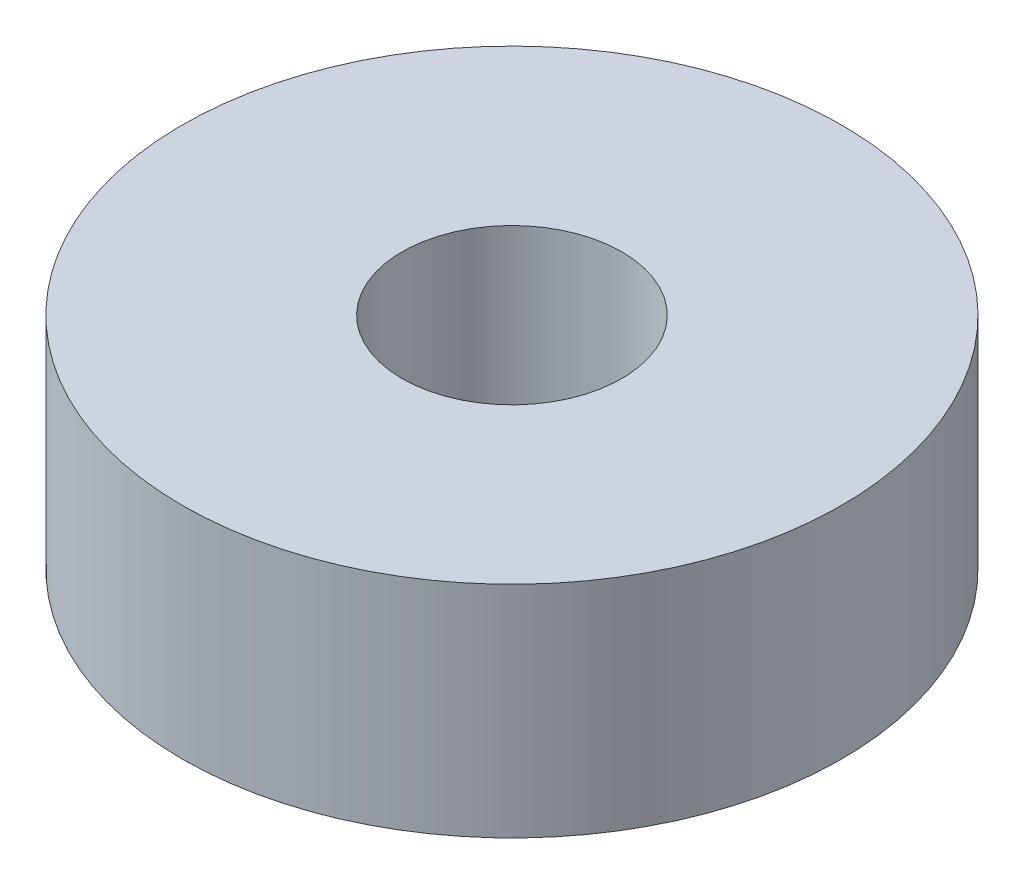
from build123d import *

# Parameters (mm, degrees)
SKETCH1_R           = 6
SKETCH1_R_2         = 2
BOSS_EXTRUDE1_DEPTH = 4


with BuildPart() as part:
    # Sketch1 → Boss-Extrude1 (new body)
    with BuildSketch(Plane(origin=(0, 0, 0), x_dir=(1, 0, 0), z_dir=(0, 1, 0))):
        with Locations(Location((8.377219836, 0, 0), (0, 0, 270))):
            Circle(SKETCH1_R)
        with Locations(Location((8.377219836, 0, 0), (0, 0, 270))):
            Circle(SKETCH1_R_2, mode=Mode.SUBTRACT)
    extrude(amount=BOSS_EXTRUDE1_DEPTH)


solid = part.part
